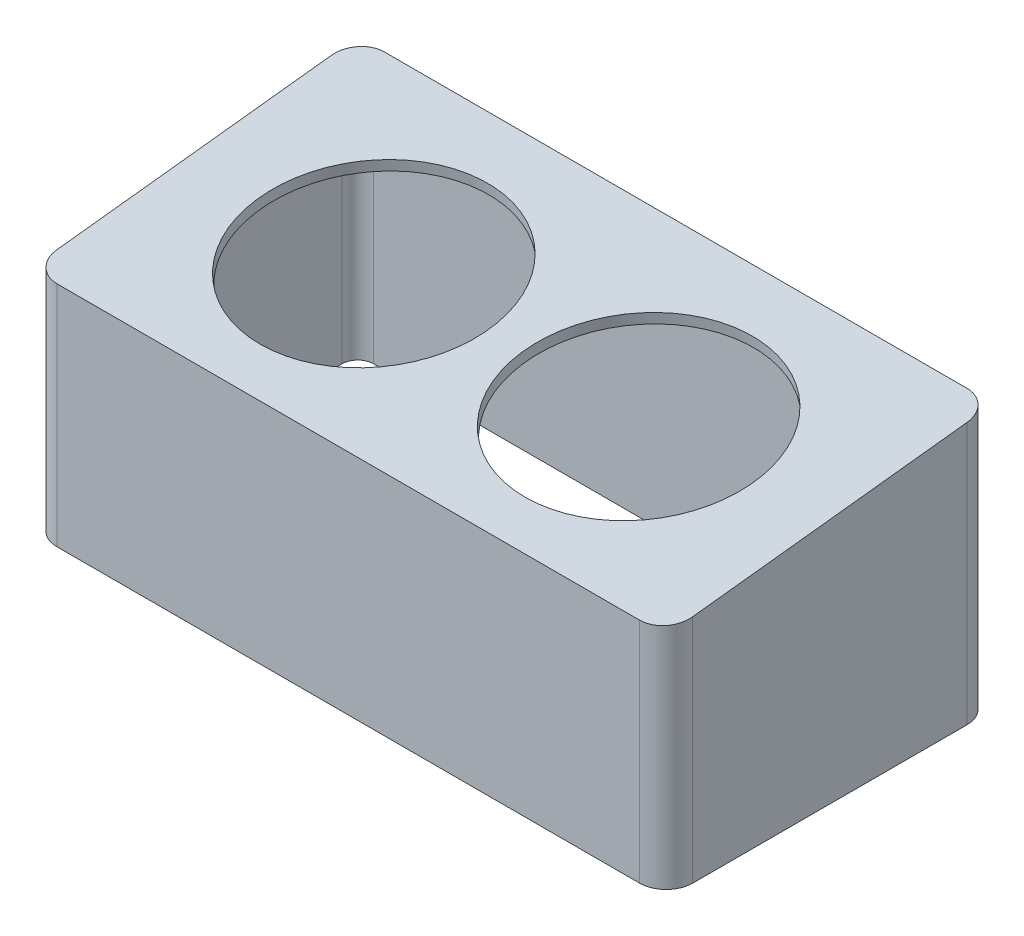
from build123d import *

# Parameters (mm, degrees)
EXTRUDE_6_DEPTH          = 50
CUT_EXTRUDE_1_DEPTH      = 134.718463472
CUT_EXTRUDE_1_DEPTH_BACK = 134.718463472
SKETCH_5_R               = 21.601831088
CUT_EXTRUDE_2_DEPTH      = 99.714931123
SHELL_3_T                = -2


with BuildPart() as part:
    # 草图3 → 凸台-拉伸6 (new body)
    with BuildSketch(Plane(origin=(0, 0, 0), x_dir=(1, 0, 0), z_dir=(0, 1, 0))):
        with BuildLine():
            Line((-35.258285714, 30.485027968), (74.741714286, 30.485027968))
            ThreePointArc((74.741714286, 30.485027968), (78.277248192, 29.020561874), (79.741714286, 25.485027968))
            Line((79.741714286, 25.485027968), (79.741714286, -26.314972032))
            ThreePointArc((79.741714286, -26.314972032), (78.277248192, -29.850505938), (74.741714286, -31.314972032))
            Line((74.741714286, -31.314972032), (-35.258285714, -31.314972032))
            ThreePointArc((-35.258285714, -31.314972032), (-38.79381962, -29.850505938), (-40.258285714, -26.314972032))
            Line((-40.258285714, -26.314972032), (-40.258285714, 25.485027968))
            ThreePointArc((-40.258285714, 25.485027968), (-38.79381962, 29.020561874), (-35.258285714, 30.485027968))
        make_face()
    extrude(amount=EXTRUDE_6_DEPTH)

    # 草图4 → 切除-拉伸1 (cut, two sides: drawn at the far end of the back side and taken through both)
    with BuildSketch(Plane(origin=(79.741714286, 0, 0), x_dir=(0, 0, -1), z_dir=(1, 0, 0)).offset(-CUT_EXTRUDE_1_DEPTH_BACK)):
        Polygon((30.485027968, 50), (-31.314972032, 43), (-31.314972032, 50), align=None)
    extrude(amount=CUT_EXTRUDE_1_DEPTH + CUT_EXTRUDE_1_DEPTH_BACK, mode=Mode.SUBTRACT)

    # 草图5 → 切除-拉伸2 (cut, through all)
    with BuildSketch(Plane(origin=(0, 45.957380333, 5.205528517), x_dir=(1, 0, 0), z_dir=(0, 0.9936461847514532, 0.11254892060291542))):
        with Locations(Location((44.741714286, 3.723601101, 0), (0, 0, 270))):
            Circle(SKETCH_5_R)
        with Locations(Location((-5.258285714, 3.723601101, 0), (0, 0, 270))):
            Circle(SKETCH_5_R)
    extrude(amount=-CUT_EXTRUDE_2_DEPTH, mode=Mode.SUBTRACT)

    # 抽壳3
    shell_3_openings = [part.faces().sort_by_distance(p)[0] for p in [
        (-5.258285714, 24.353508562, -22.728886231),
        (44.741714286, 24.353508562, -22.728886231),
        (19.741714286, 0, 3.178829845),
    ]]
    offset(amount=SHELL_3_T, openings=shell_3_openings, kind=Kind.INTERSECTION)


solid = part.part
